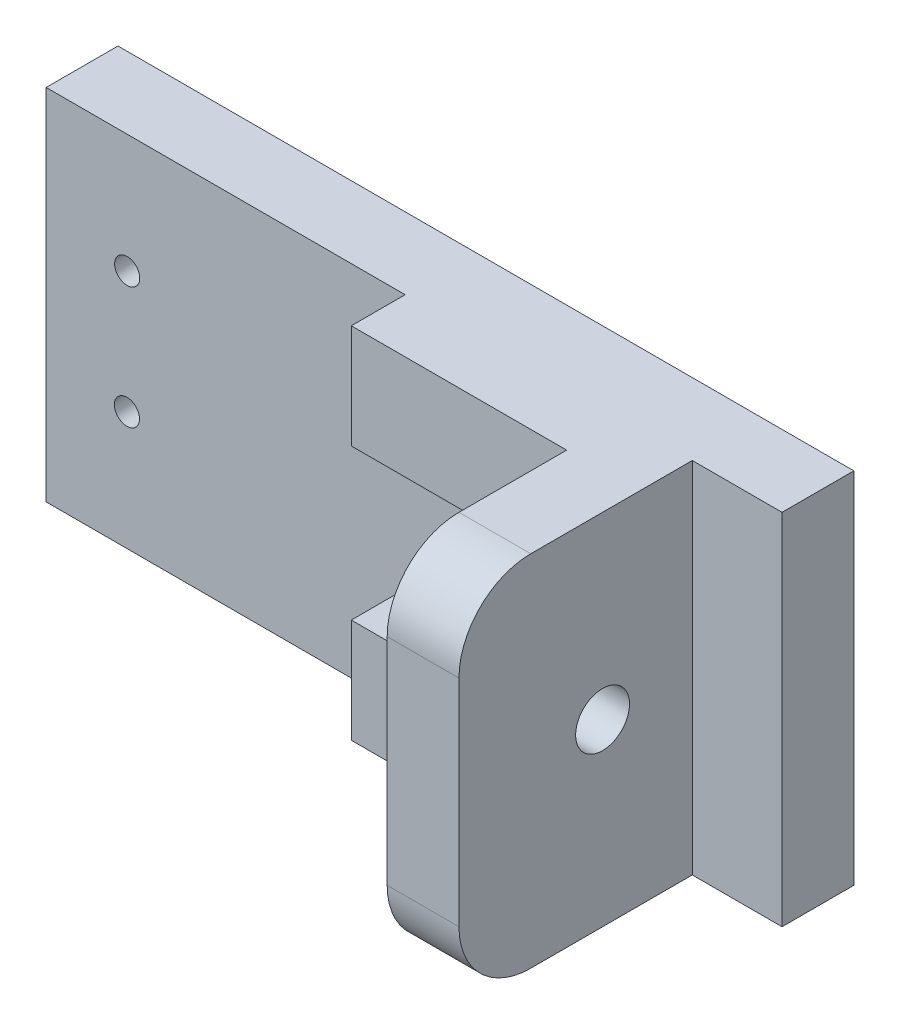
from build123d import *

# Parameters (mm, degrees)
SCHIZZO1_W                   = 205
SCHIZZO1_H                   = 100
ESTRUSIONE_ESTRUSIONE1_DEPTH = 20
FORO_FILETTATO_M8X1_0_1_D    = 7
SCHIZZO6_W                   = 60
SCHIZZO6_H                   = 29
ESTRUSIONE_ESTRUSIONE2_DEPTH = 15
SCHIZZO7_W                   = 20
SCHIZZO7_H                   = 100
ESTRUSIONE_ESTRUSIONE3_DEPTH = 65
SCHIZZO8_R                   = 7.5
TAGLIO_ESTRUSIONE1_DEPTH     = 206.243757518
RACCORDO1_R                  = 20


with BuildPart() as part:
    # Schizzo1 → Estrusione-Estrusione1 (new body)
    with BuildSketch(Plane.XY):
        Rectangle(SCHIZZO1_W, SCHIZZO1_H)
    extrude(amount=ESTRUSIONE_ESTRUSIONE1_DEPTH)

    # Foro filettato M8x1.0-1 (through all)
    with Locations(Plane(origin=(0, 0, 0), x_dir=(-1, 0, 0), z_dir=(0, 0, -1))):
        with Locations((79.93168314, 16.999931365), (80, -17)):
            Hole(FORO_FILETTATO_M8X1_0_1_D / 2)

    # Schizzo6 → Estrusione-Estrusione2 (add)
    with BuildSketch(Plane.XY.offset(20)):
        with Locations((27.5, -35.5)):
            Rectangle(SCHIZZO6_W, SCHIZZO6_H)
        with Locations((27.5, 35.5)):
            Rectangle(SCHIZZO6_W, SCHIZZO6_H)
    extrude(amount=ESTRUSIONE_ESTRUSIONE2_DEPTH)

    # Schizzo7 → Estrusione-Estrusione3 (add)
    with BuildSketch(Plane.XY.offset(20)):
        with Locations((67.5, 0)):
            Rectangle(SCHIZZO7_W, SCHIZZO7_H)
    extrude(amount=ESTRUSIONE_ESTRUSIONE3_DEPTH)

    # Schizzo8 → Taglio-Estrusione1 (cut, through all)
    with BuildSketch(Plane(origin=(77.5, 0, 0), x_dir=(0, 0, -1), z_dir=(1, 0, 0))):
        with Locations((-45, 0)):
            Circle(SCHIZZO8_R)
    extrude(amount=-TAGLIO_ESTRUSIONE1_DEPTH, mode=Mode.SUBTRACT)

    # Raccordo1
    raccordo1_edges = [part.edges().sort_by_distance(p)[0] for p in [
        (67.5, -50, 85),
        (67.5, 50, 85),
    ]]
    fillet(raccordo1_edges, radius=RACCORDO1_R)


solid = part.part
